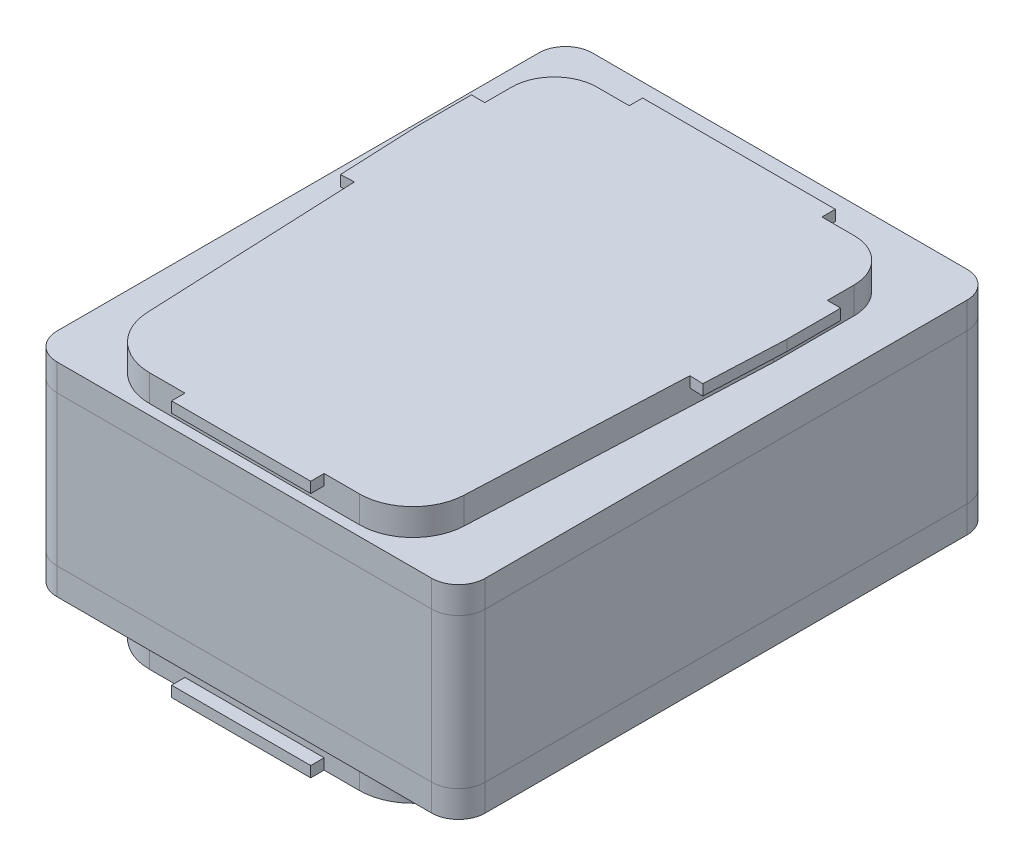
from build123d import *

# Parameters (mm, degrees)
SKETCH8_R                        = 10
BOSS_EXTRUDE6_DEPTH              = 5
BOSS_EXTRUDE7_START              = 5
BOSS_EXTRUDE7_DEPTH              = 5
EXTRUDE_THIN4_DEPTH              = 8
EXTRUDE_THIN4_DEPTH_BACK         = 20
SKETCH2_W                        = 70
SKETCH2_H                        = 90
BOSS_EXTRUDE8_DEPTH              = 5
BOSS_EXTRUDE9_DEPTH              = 5
BOSS_EXTRUDE10_REACH             = 81.849
SKETCH13_W                       = 6.5
SKETCH13_H                       = 17.8
BOSS_EXTRUDE10_DIRECTION_2_REACH = 81.849
SKETCH15_R                       = 2.25
CUT_EXTRUDE1_DEPTH               = 17.8
SKETCH17_W                       = 36
SKETCH17_H                       = 3
SKETCH17_W_2                     = 26
BOSS_EXTRUDE11_DEPTH             = 2
SKETCH18_W                       = 36
SKETCH18_H                       = 3
SKETCH18_W_2                     = 26
BOSS_EXTRUDE12_DEPTH             = 2


with BuildPart() as part:
    # Sketch8 → Boss-Extrude6 (new body)
    with BuildSketch(Plane(origin=(0, 0, 0), x_dir=(-1, 0, 0), z_dir=(0, 1, 0))):
        with BuildLine():
            Line((32, -36), (32, -21))
            Line((32, -21), (29.579603504, 34.436193874))
            ThreePointArc((29.579603504, 34.436193874), (26.504251846, 41.223639621), (19.589121288, 44))
            Line((19.589121288, 44), (-19.589121288, 44))
            ThreePointArc((-19.589121288, 44), (-26.504251846, 41.223639621), (-29.579603504, 34.436193874))
            Line((-29.579603504, 34.436193874), (-32, -21))
            Line((-32, -21), (-32, -36))
            ThreePointArc((-32, -36), (-29.656854249, -41.656854249), (-24, -44))
            Line((-24, -44), (24, -44))
            ThreePointArc((24, -44), (29.656854249, -41.656854249), (32, -36))
        make_face()
        with Locations(Location((15.9, 11.8, 0), (0, 0, 90))):
            Circle(SKETCH8_R, mode=Mode.SUBTRACT)
        with Locations(Location((-15.9, 11.8, 0), (0, 0, 90))):
            Circle(SKETCH8_R, mode=Mode.SUBTRACT)
        with Locations(Location((15.9, -20, 0), (0, 0, 90))):
            Circle(SKETCH8_R, mode=Mode.SUBTRACT)
        with Locations(Location((-15.9, -20, 0), (0, 0, 90))):
            Circle(SKETCH8_R, mode=Mode.SUBTRACT)
    extrude(amount=-BOSS_EXTRUDE6_DEPTH)

    # Sketch1 → Boss-Extrude7 (add)
    # profile 1 of 2: a face of its own
    with BuildSketch(Plane(origin=(0, 0, 0), x_dir=(1, 0, 0), z_dir=(0, 1, 0)).offset(BOSS_EXTRUDE7_START)):
        with BuildLine():
            Line((-35, 54.1), (35, 54.1))
            ThreePointArc((35, 54.1), (38.535533906, 52.635533906), (40, 49.1))
            Line((40, 49.1), (40, -40.9))
            ThreePointArc((40, -40.9), (38.535533906, -44.435533906), (35, -45.9))
            Line((35, -45.9), (-35, -45.9))
            ThreePointArc((-35, -45.9), (-38.535533906, -44.435533906), (-40, -40.9))
            Line((-40, -40.9), (-40, 49.1))
            ThreePointArc((-40, 49.1), (-38.535533906, 52.635533906), (-35, 54.1))
        make_face()
        with BuildLine():
            ThreePointArc((32, 36), (29.656854249, 41.656854249), (24, 44))
            Line((24, 44), (-24, 44))
            ThreePointArc((-24, 44), (-29.656854249, 41.656854249), (-32, 36))
            Line((-32, 36), (-32, 21))
            Line((-32, 21), (-29.579603504, -34.436193874))
            ThreePointArc((-29.579603504, -34.436193874), (-26.504251846, -41.223639621), (-19.589121288, -44))
            Line((-19.589121288, -44), (19.589121288, -44))
            ThreePointArc((19.589121288, -44), (26.504251846, -41.223639621), (29.579603504, -34.436193874))
            Line((29.579603504, -34.436193874), (32, 21))
            Line((32, 21), (32, 36))
        make_face(mode=Mode.SUBTRACT)
    # profile 2 of 2: a face of its own
    with BuildSketch(Plane(origin=(0, 0, 0), x_dir=(1, 0, 0), z_dir=(0, 1, 0)).offset(BOSS_EXTRUDE7_START)):
        with BuildLine():
            Line((32, 36), (32, 21))
            Line((32, 21), (29.579603504, -34.436193874))
            ThreePointArc((29.579603504, -34.436193874), (26.504251846, -41.223639621), (19.589121288, -44))
            Line((19.589121288, -44), (-19.589121288, -44))
            ThreePointArc((-19.589121288, -44), (-26.504251846, -41.223639621), (-29.579603504, -34.436193874))
            Line((-29.579603504, -34.436193874), (-32, 21))
            Line((-32, 21), (-32, 36))
            ThreePointArc((-32, 36), (-29.656854249, 41.656854249), (-24, 44))
            Line((-24, 44), (24, 44))
            ThreePointArc((24, 44), (29.656854249, 41.656854249), (32, 36))
        make_face()
        with BuildLine():
            ThreePointArc((-24, 41), (-27.535533906, 39.535533906), (-29, 36))
            Line((-29, 36), (-29, 21.065460233))
            Line((-29, 21.065460233), (-26.582458839, -34.305335712))
            ThreePointArc((-26.582458839, -34.305335712), (-24.429712679, -39.056547734), (-19.589121288, -41))
            Line((-19.589121288, -41), (19.589121288, -41))
            ThreePointArc((19.589121288, -41), (24.429712679, -39.056547734), (26.582458839, -34.305335712))
            Line((26.582458839, -34.305335712), (29, 21.065460233))
            Line((29, 21.065460233), (29, 36))
            ThreePointArc((29, 36), (27.535533906, 39.535533906), (24, 41))
            Line((24, 41), (-24, 41))
        make_face(mode=Mode.SUBTRACT)
    extrude(amount=-BOSS_EXTRUDE7_DEPTH)

    # Sketch17 → Boss-Extrude11 (add)
    with BuildSketch(Plane(origin=(0, -5, 0), x_dir=(1, 0, 0), z_dir=(0, 1, 0))):
        with Locations((0, 45)):
            Rectangle(SKETCH17_W, SKETCH17_H)
        with Locations((0, -45)):
            Rectangle(SKETCH17_W_2, SKETCH17_H)
        Polygon((-31.5, 21.010910039), (-30.84570919, 6.025186715), (-33.842853854, 5.894328553), (-34.5, 20.945449806), (-34.5, 31.010910039), (-31.5, 31.010910039), align=None)
        Polygon((31.5, 21.010910039), (31.5, 31.010910039), (34.5, 31.010910039), (34.5, 20.945449806), (33.842853854, 5.894328553), (30.84570919, 6.025186715), align=None)
    extrude(amount=BOSS_EXTRUDE11_DEPTH)


with BuildPart() as body_2:
    # Sketch2 → Extrude-Thin4 (new, two sides: drawn at the far end of the back side and taken through both)
    with BuildSketch(Plane(origin=(0, 25, 0), x_dir=(1, 0, 0), z_dir=(0, 1, 0)).offset(-EXTRUDE_THIN4_DEPTH_BACK)):
        with BuildLine():
            Line((-40, 49.1), (-40, -40.9))
            ThreePointArc((-40, -40.9), (-38.535533906, -44.435533906), (-35, -45.9))
            Line((-35, -45.9), (35, -45.9))
            ThreePointArc((35, -45.9), (38.535533906, -44.435533906), (40, -40.9))
            Line((40, -40.9), (40, 49.1))
            ThreePointArc((40, 49.1), (38.535533906, 52.635533906), (35, 54.1))
            Line((35, 54.1), (-35, 54.1))
            ThreePointArc((-35, 54.1), (-38.535533906, 52.635533906), (-40, 49.1))
        make_face()
        with Locations((0, 4.1)):
            Rectangle(SKETCH2_W, SKETCH2_H, mode=Mode.SUBTRACT)
    extrude(amount=EXTRUDE_THIN4_DEPTH + EXTRUDE_THIN4_DEPTH_BACK)

    # Sketch13 → Boss-Extrude10 (add, up to next)
    with BuildSketch(Plane(origin=(0, 0, 0), x_dir=(0, 0, -1), z_dir=(1, 0, 0)), mode=Mode.PRIVATE) as boss_extrude10_sk1:
        with Locations((45.85, 20)):
            Rectangle(SKETCH13_W, SKETCH13_H)
    boss_extrude10_tool1 = extrude(boss_extrude10_sk1.sketch, amount=BOSS_EXTRUDE10_REACH, mode=Mode.PRIVATE) - body_2.part
    # Sketch13 → Boss-Extrude10 (add, up to next)
    with BuildSketch(Plane(origin=(0, 0, 0), x_dir=(0, 0, -1), z_dir=(1, 0, 0)), mode=Mode.PRIVATE) as boss_extrude10_sk2:
        with Locations((-37.65, 20)):
            Rectangle(SKETCH13_W, SKETCH13_H)
    boss_extrude10_tool2 = extrude(boss_extrude10_sk2.sketch, amount=BOSS_EXTRUDE10_REACH, mode=Mode.PRIVATE) - body_2.part
    add(boss_extrude10_tool1.solids().sort_by_distance((0, 20, -45.85))[0])
    add(boss_extrude10_tool2.solids().sort_by_distance((0, 20, 37.65))[0])

    # Sketch13 → Boss-Extrude10 direction 2 (add, up to next)
    with BuildSketch(Plane(origin=(0, 0, 0), x_dir=(0, 0, -1), z_dir=(1, 0, 0)), mode=Mode.PRIVATE) as boss_extrude10_direction_2_sk1:
        with Locations((45.85, 20)):
            Rectangle(SKETCH13_W, SKETCH13_H)
    boss_extrude10_direction_2_tool1 = extrude(boss_extrude10_direction_2_sk1.sketch, amount=-BOSS_EXTRUDE10_DIRECTION_2_REACH, mode=Mode.PRIVATE) - body_2.part
    # Sketch13 → Boss-Extrude10 direction 2 (add, up to next)
    with BuildSketch(Plane(origin=(0, 0, 0), x_dir=(0, 0, -1), z_dir=(1, 0, 0)), mode=Mode.PRIVATE) as boss_extrude10_direction_2_sk2:
        with Locations((-37.65, 20)):
            Rectangle(SKETCH13_W, SKETCH13_H)
    boss_extrude10_direction_2_tool2 = extrude(boss_extrude10_direction_2_sk2.sketch, amount=-BOSS_EXTRUDE10_DIRECTION_2_REACH, mode=Mode.PRIVATE) - body_2.part
    add(boss_extrude10_direction_2_tool1.solids().sort_by_distance((0, 20, -45.85))[0])
    add(boss_extrude10_direction_2_tool2.solids().sort_by_distance((0, 20, 37.65))[0])

    # Sketch15 → Cut-Extrude1 (cut)
    with BuildSketch(Plane.XZ.offset(-11.1)):
        with Locations((-21.9, -44)):
            Circle(SKETCH15_R)
        with Locations((-9.9, -44)):
            Circle(SKETCH15_R)
        with Locations((-21.9, 35.8)):
            Circle(SKETCH15_R)
        with Locations((-9.9, 35.8)):
            Circle(SKETCH15_R)
        with Locations((9.9, 35.8)):
            Circle(SKETCH15_R)
        with Locations((21.9, 35.8)):
            Circle(SKETCH15_R)
        with Locations((9.9, -44)):
            Circle(SKETCH15_R)
        with Locations((21.9, -44)):
            Circle(SKETCH15_R)
    extrude(amount=-CUT_EXTRUDE1_DEPTH, mode=Mode.SUBTRACT)


with BuildPart() as body_3:
    # Sketch10 → Boss-Extrude8 (new body)
    with BuildSketch(Plane(origin=(0, 38, 0), x_dir=(1, 0, 0), z_dir=(0, 1, 0))):
        with BuildLine():
            Line((-32, 36), (-32, 21))
            Line((-32, 21), (-29.579603504, -34.436193874))
            ThreePointArc((-29.579603504, -34.436193874), (-26.504251846, -41.223639621), (-19.589121288, -44))
            Line((-19.589121288, -44), (19.589121288, -44))
            ThreePointArc((19.589121288, -44), (26.504251846, -41.223639621), (29.579603504, -34.436193874))
            Line((29.579603504, -34.436193874), (32, 21))
            Line((32, 21), (32, 36))
            ThreePointArc((32, 36), (29.656854249, 41.656854249), (24, 44))
            Line((24, 44), (-24, 44))
            ThreePointArc((-24, 44), (-29.656854249, 41.656854249), (-32, 36))
        make_face()
    extrude(amount=BOSS_EXTRUDE8_DEPTH)

    # Sketch11 → Boss-Extrude9 (add)
    with BuildSketch(Plane(origin=(0, 38, 0), x_dir=(1, 0, 0), z_dir=(0, 1, 0))):
        with BuildLine():
            Line((-35, -45.9), (35, -45.9))
            ThreePointArc((35, -45.9), (38.535533906, -44.435533906), (40, -40.9))
            Line((40, -40.9), (40, 49.1))
            ThreePointArc((40, 49.1), (38.535533906, 52.635533906), (35, 54.1))
            Line((35, 54.1), (-35, 54.1))
            ThreePointArc((-35, 54.1), (-38.535533906, 52.635533906), (-40, 49.1))
            Line((-40, 49.1), (-40, -40.9))
            ThreePointArc((-40, -40.9), (-38.535533906, -44.435533906), (-35, -45.9))
        make_face()
    extrude(amount=-BOSS_EXTRUDE9_DEPTH)

    # Sketch18 → Boss-Extrude12 (add)
    with BuildSketch(Plane(origin=(0, 43, 0), x_dir=(1, 0, 0), z_dir=(0, 1, 0))):
        with Locations((0, 45)):
            Rectangle(SKETCH18_W, SKETCH18_H)
        with Locations((0, -45)):
            Rectangle(SKETCH18_W_2, SKETCH18_H)
        Polygon((-31.5, 21.010910039), (-30.84570919, 6.025186715), (-33.842853854, 5.894328553), (-34.5, 20.945449806), (-34.5, 31.010910039), (-31.5, 31.010910039), align=None)
        Polygon((31.5, 21.010910039), (31.5, 31.010910039), (34.5, 31.010910039), (34.5, 20.945449806), (33.842853854, 5.894328553), (30.84570919, 6.025186715), align=None)
    extrude(amount=-BOSS_EXTRUDE12_DEPTH)


solid = Compound([part.part, body_2.part, body_3.part])
